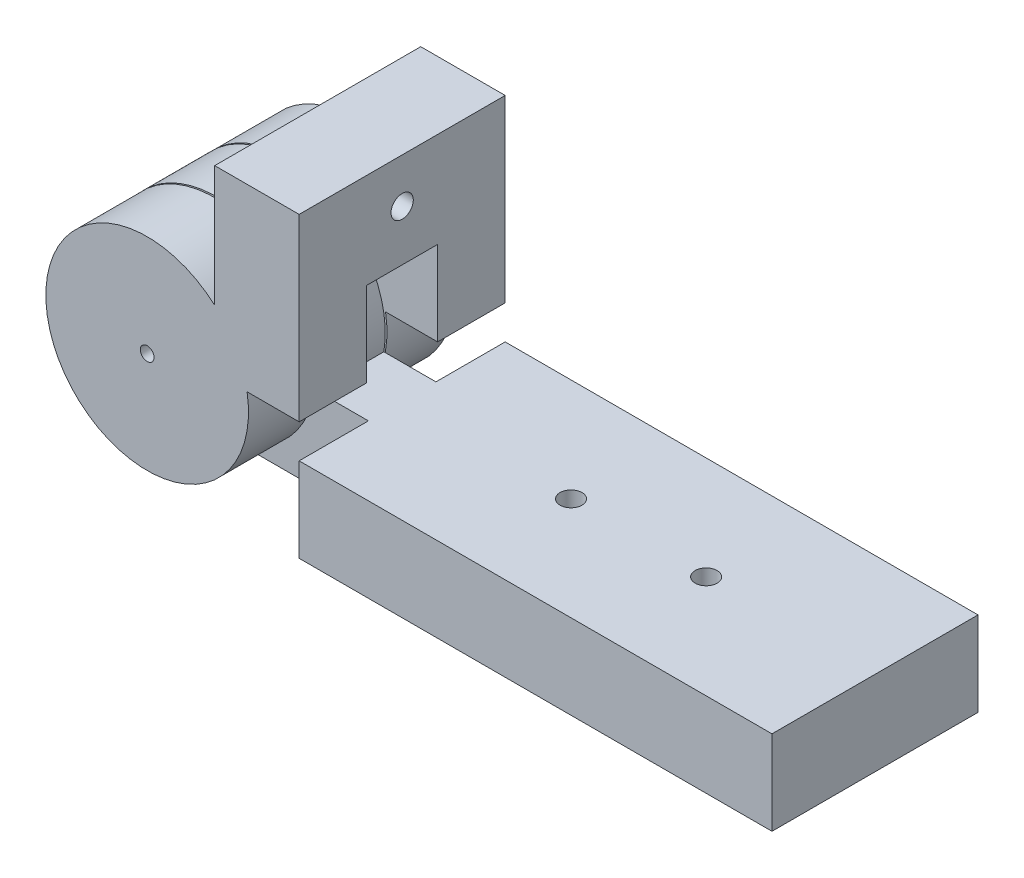
from build123d import *

# Parameters (mm, degrees)
SKETCH1_R           = 19.05
BOSS_EXTRUDE1_DEPTH = 6.35
BOSS_EXTRUDE2_DEPTH = 12.7
SKETCH3_R           = 6.35
CUT_EXTRUDE1_DEPTH  = 111.807045128
SKETCH4_R           = 5.715
BOSS_EXTRUDE3_DEPTH = 6.6675
BOSS_EXTRUDE4_START = 12.7
SKETCH5_R           = 19.05
BOSS_EXTRUDE4_DEPTH = 12.7
BOSS_EXTRUDE5_DEPTH = 12.7
BOSS_EXTRUDE6_REACH = 115.114
SKETCH7_W           = 15.875
SKETCH7_H           = 60.325
BOSS_EXTRUDE7_START = -25.7175
SKETCH8_W           = 88.9
SKETCH8_H           = 15.875
BOSS_EXTRUDE7_DEPTH = 38.735
SKETCH16_R          = 2.0955
CUT_EXTRUDE8_DEPTH  = 123.441848672
SKETCH17_R          = 2.06375
CUT_EXTRUDE9_DEPTH  = 126.16951778
SKETCH20_W          = 38.735
SKETCH20_H          = 42.418
CUT_EXTRUDE12_DEPTH = 123.441848672
SKETCH21_R          = 1.288075885
CUT_EXTRUDE13_DEPTH = 117.693236629


with BuildPart() as part:
    # Sketch1 → Boss-Extrude1 (new, symmetric)
    with BuildSketch(Plane.XY):
        with Locations((-73.025, -41.275)):
            Circle(SKETCH1_R)
    extrude(amount=BOSS_EXTRUDE1_DEPTH, both=True)

    # Sketch2 → Boss-Extrude2 (add)
    with BuildSketch(Plane.XY.offset(6.35)):
        with BuildLine():
            Line((-54.241446689, -44.45), (44.45, -44.45))
            Line((44.45, -44.45), (44.45, -60.325))
            Line((44.45, -60.325), (-73.025, -60.325))
            ThreePointArc((-73.025, -60.325), (-60.728277876, -55.824677831), (-54.241446689, -44.45))
        make_face()
    extrude(amount=-BOSS_EXTRUDE2_DEPTH)

    # Sketch3 → Cut-Extrude1 (cut, through all)
    with BuildSketch(Plane.XY.offset(6.35)):
        with Locations((-73.025, -41.275)):
            Circle(SKETCH3_R)
    extrude(amount=-CUT_EXTRUDE1_DEPTH, mode=Mode.SUBTRACT)

    # Sketch8 → Boss-Extrude7 (add)
    with BuildSketch(Plane.XY.offset(6.35).offset(BOSS_EXTRUDE7_START)):
        with Locations((0, -52.3875)):
            Rectangle(SKETCH8_W, SKETCH8_H)
    extrude(amount=BOSS_EXTRUDE7_DEPTH)

    # Sketch17 → Cut-Extrude9 (cut, through all)
    with BuildSketch(Plane(origin=(0, -44.45, 0), x_dir=(1, 0, 0), z_dir=(0, 1, 0))):
        with Locations(Location((-12.7, 0, 0), (0, 0, 180))):
            Circle(SKETCH17_R)
        with Locations(Location((12.7, 0, 0), (0, 0, 180))):
            Circle(SKETCH17_R)
    extrude(amount=-CUT_EXTRUDE9_DEPTH, mode=Mode.SUBTRACT)


with BuildPart() as body_2:
    # Sketch4 → Boss-Extrude3 (new, symmetric)
    with BuildSketch(Plane.XY):
        with Locations((-73.025, -41.275)):
            Circle(SKETCH4_R)
    extrude(amount=BOSS_EXTRUDE3_DEPTH, both=True)

    # Sketch5 → Boss-Extrude4 (add)
    with BuildSketch(Plane.XY.offset(6.6675).offset(BOSS_EXTRUDE4_START)):
        with Locations((-73.025, -41.275)):
            Circle(SKETCH5_R)
    boss_extrude4 = extrude(amount=-BOSS_EXTRUDE4_DEPTH)

    # Sketch6 → Boss-Extrude5 (add)
    with BuildSketch(Plane.XY.offset(19.3675)):
        with BuildLine():
            Line((-44.45, -38.1), (-44.45, 38.1))
            Line((-44.45, 38.1), (-60.325, 38.1))
            Line((-60.325, 38.1), (-60.325, -27.075968343))
            ThreePointArc((-60.325, -27.075968343), (-56.346095636, -32.070835224), (-54.241446689, -38.1))
            Line((-54.241446689, -38.1), (-44.45, -38.1))
        make_face()
    boss_extrude5 = extrude(amount=-BOSS_EXTRUDE5_DEPTH)

    # Mirror1: Boss-Extrude4, Boss-Extrude5 across plane
    add(boss_extrude4.mirror(Plane.XY))
    add(boss_extrude5.mirror(Plane.XY))

    # Sketch7 → Boss-Extrude6 (add, up to next)
    with BuildSketch(Plane(origin=(0, 0, 6.6675), x_dir=(-1, 0, 0), z_dir=(0, 0, -1)), mode=Mode.PRIVATE) as boss_extrude6_sk1:
        with Locations((52.3875, 7.9375)):
            Rectangle(SKETCH7_W, SKETCH7_H)
    boss_extrude6_tool1 = extrude(boss_extrude6_sk1.sketch, amount=BOSS_EXTRUDE6_REACH, mode=Mode.PRIVATE) - body_2.part
    add(boss_extrude6_tool1.solids().sort_by_distance((-52.3875, 7.9375, 6.6675))[0])

    # Sketch16 → Cut-Extrude8 (cut, through all)
    with BuildSketch(Plane.ZY.offset(60.325)):
        with Locations(Location((0, 12.7, 0), (0, 0, 270))):
            Circle(SKETCH16_R)
        with Locations(Location((0, -12.7, 0), (0, 0, 270))):
            Circle(SKETCH16_R)
    extrude(amount=-CUT_EXTRUDE8_DEPTH, mode=Mode.SUBTRACT)

    # Sketch20 → Cut-Extrude12 (cut, through all)
    with BuildSketch(Plane.ZY.offset(60.325)):
        with Locations((0, 16.891)):
            Rectangle(SKETCH20_W, SKETCH20_H)
    extrude(amount=-CUT_EXTRUDE12_DEPTH, mode=Mode.SUBTRACT)

    # Sketch21 → Cut-Extrude13 (cut, through all)
    with BuildSketch(Plane.XY.offset(19.3675)):
        with Locations((-73.025, -41.275)):
            Circle(SKETCH21_R)
    extrude(amount=-CUT_EXTRUDE13_DEPTH, mode=Mode.SUBTRACT)


solid = Compound([part.part, body_2.part])
